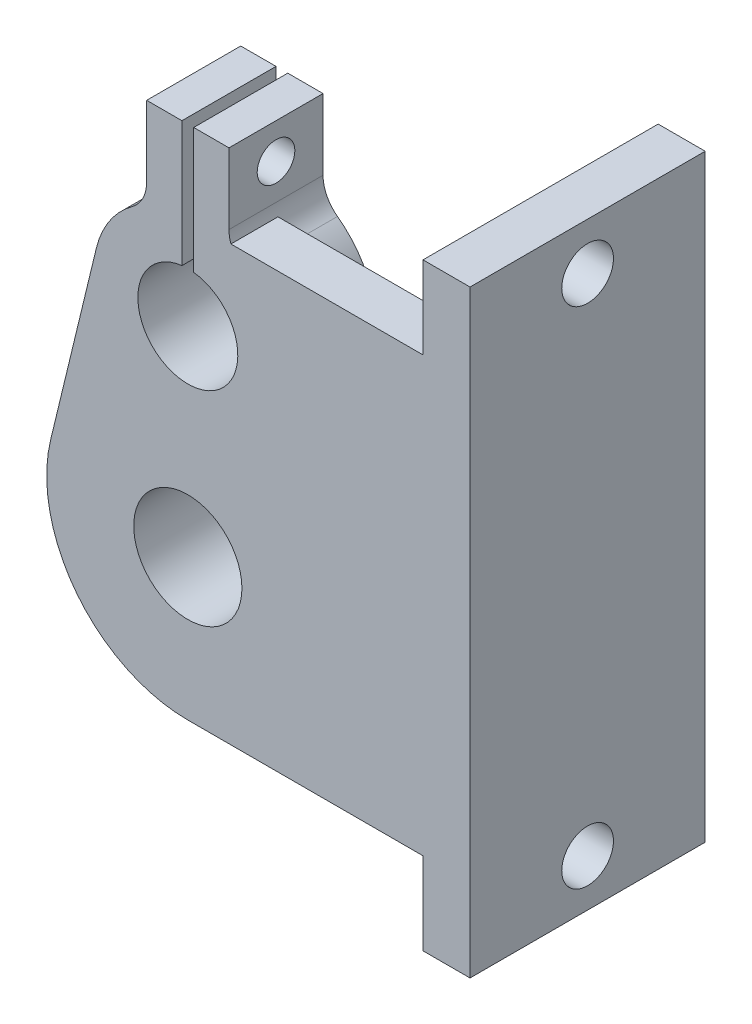
from build123d import *

# Parameters (mm, degrees)
SKETCH_1_R          = 4.6
EXTRUDE_1_DEPTH     = 4
EXTRUDE_START       = -4
SKETCH_1_4_R        = 4.6
EXTRUDE_2_DEPTH     = 4
EXTRUDE_3_DEPTH     = 12
SKETCH_4_R          = 2.2
CUT_EXTRUDE_2_DEPTH = 64.857250973
SKETCH_4_3_R        = 1.6
CUT_EXTRUDE_3_DEPTH = 64.857250973
RIB_6_REACH         = 62.9
SKETCH_6_WALL_W     = 139.031153846
SKETCH_6_WALL_H     = 5
RIB_7_REACH         = 62.9
SKETCH_8_WALL_W     = 139.031153846
SKETCH_8_WALL_H     = 5


with BuildPart() as part:
    # 草图1 → 凸台-拉伸1 (new body)
    with BuildSketch(Plane.XY):
        with BuildLine():
            ThreePointArc((19.272727273, 44.453905218), (17.343879539, 42.438024382), (16.224606286, 39.882352941))
            Line((16.224606286, 39.882352941), (12.336909429, 23.823529412))
            ThreePointArc((12.336909429, 23.823529412), (14.569137024, 13.579836691), (24, 9))
            Line((24, 9), (44, 9))
            Line((44, 9), (44, 2))
            Line((44, 2), (48, 2))
            Line((48, 2), (48, 52.893747285))
            Line((48, 52.893747285), (44, 52.893747285))
            Line((44, 52.893747285), (44, 45.893747285))
            Line((44, 45.893747285), (27.664709895, 45.893747285))
            ThreePointArc((27.664709895, 45.893747285), (27.541464018, 46.377063498), (27.5, 46.874119675))
            Line((27.5, 46.874119675), (27.5, 52.893747285))
            Line((27.5, 52.893747285), (24.5, 52.893747285))
            Line((24.5, 52.893747285), (24.5, 42.220485754))
            ThreePointArc((24.5, 42.220485754), (24, 33.75), (23.5, 42.220485754))
            Line((23.5, 42.220485754), (23.5, 52.893747285))
            Line((23.5, 52.893747285), (20.5, 52.893747285))
            Line((20.5, 52.893747285), (20.5, 46.874119675))
            ThreePointArc((20.5, 46.874119675), (20.458535982, 46.377063498), (20.335290105, 45.893747285))
            ThreePointArc((20.335290105, 45.893747285), (19.913864605, 45.092755684), (19.272727273, 44.453905218))
        make_face()
        with Locations((24, 21)):
            Circle(SKETCH_1_R, mode=Mode.SUBTRACT)
    extrude(amount=EXTRUDE_1_DEPTH)

    # 草图1<4> → 凸台-拉伸2 (add)
    # profile 1 of 2: a face of its own
    with BuildSketch(Plane.XY.offset(EXTRUDE_START)):
        Polygon((44, 45.893747285), (44, 52.893747285), (48, 52.893747285), (48, 2), (44, 2), (44, 9), align=None)
    # profile 2 of 2: a face of its own
    with BuildSketch(Plane.XY.offset(EXTRUDE_START)):
        with BuildLine():
            ThreePointArc((27.5, 46.874119675), (27.824352245, 45.517318624), (28.727272727, 44.453905218))
            ThreePointArc((28.727272727, 44.453905218), (30.656120461, 42.438024382), (31.775393714, 39.882352941))
            Line((31.775393714, 39.882352941), (35.663090571, 23.823529412))
            ThreePointArc((35.663090571, 23.823529412), (24, 9), (12.336909429, 23.823529412))
            Line((12.336909429, 23.823529412), (16.224606286, 39.882352941))
            ThreePointArc((16.224606286, 39.882352941), (17.343879539, 42.438024382), (19.272727273, 44.453905218))
            ThreePointArc((19.272727273, 44.453905218), (20.175647755, 45.517318624), (20.5, 46.874119675))
            Line((20.5, 46.874119675), (20.5, 52.893747285))
            Line((20.5, 52.893747285), (23.5, 52.893747285))
            Line((23.5, 52.893747285), (23.5, 42.220485754))
            ThreePointArc((23.5, 42.220485754), (24, 33.75), (24.5, 42.220485754))
            Line((24.5, 42.220485754), (24.5, 52.893747285))
            Line((24.5, 52.893747285), (27.5, 52.893747285))
            Line((27.5, 52.893747285), (27.5, 46.874119675))
        make_face()
        with Locations((24, 21)):
            Circle(SKETCH_1_4_R, mode=Mode.SUBTRACT)
    extrude(amount=EXTRUDE_2_DEPTH)

    # 草图1<5> → 凸台-拉伸3 (add)
    with BuildSketch(Plane.XY.offset(EXTRUDE_START)):
        Polygon((44, 45.893747285), (44, 52.893747285), (48, 52.893747285), (48, 2), (44, 2), (44, 9), align=None)
    extrude(amount=-EXTRUDE_3_DEPTH)

    # 草图4 → 切除-拉伸2 (cut, through all)
    with BuildSketch(Plane(origin=(44, 0, 0), x_dir=(0, 0, -1), z_dir=(1, 0, 0))):
        with Locations(Location((6, 6, 0), (0, 0, 180))):
            Circle(SKETCH_4_R)
        with Locations(Location((6, 48.893747285, 0), (0, 0, 180))):
            Circle(SKETCH_4_R)
    extrude(amount=CUT_EXTRUDE_2_DEPTH, mode=Mode.SUBTRACT)

    # 草图4<3> → 切除-拉伸3 (cut, through all)
    with BuildSketch(Plane(origin=(44, 0, 0), x_dir=(0, 0, -1), z_dir=(1, 0, 0))):
        with Locations((0, 49.893747285)):
            Circle(SKETCH_4_3_R)
    extrude(amount=-CUT_EXTRUDE_3_DEPTH, mode=Mode.SUBTRACT)

    # 草图6 wall → 筋6 (add, up to next)
    with BuildSketch(Plane(origin=(41, 19, -7), x_dir=(-0.393919298579, 0, 0.919145030018), z_dir=(-0.919145030018, 0, -0.393919298579)), mode=Mode.PRIVATE) as rib_6_sk1:
        Rectangle(SKETCH_6_WALL_W, SKETCH_6_WALL_H)
    rib_6_tool1 = extrude(rib_6_sk1.sketch, amount=-RIB_6_REACH, mode=Mode.PRIVATE) - part.part
    add(rib_6_tool1.solids().sort_by_distance((41, 19, -7))[0])

    # 草图8 wall → 筋7 (add, up to next)
    with BuildSketch(Plane(origin=(41, 35.893747285, -7), x_dir=(-0.393919298579, 0, 0.919145030018), z_dir=(0.919145030018, 0, 0.393919298579)), mode=Mode.PRIVATE) as rib_7_sk1:
        Rectangle(SKETCH_8_WALL_W, SKETCH_8_WALL_H)
    rib_7_tool1 = extrude(rib_7_sk1.sketch, amount=RIB_7_REACH, mode=Mode.PRIVATE) - part.part
    add(rib_7_tool1.solids().sort_by_distance((41, 35.893747285, -7))[0])


solid = part.part
